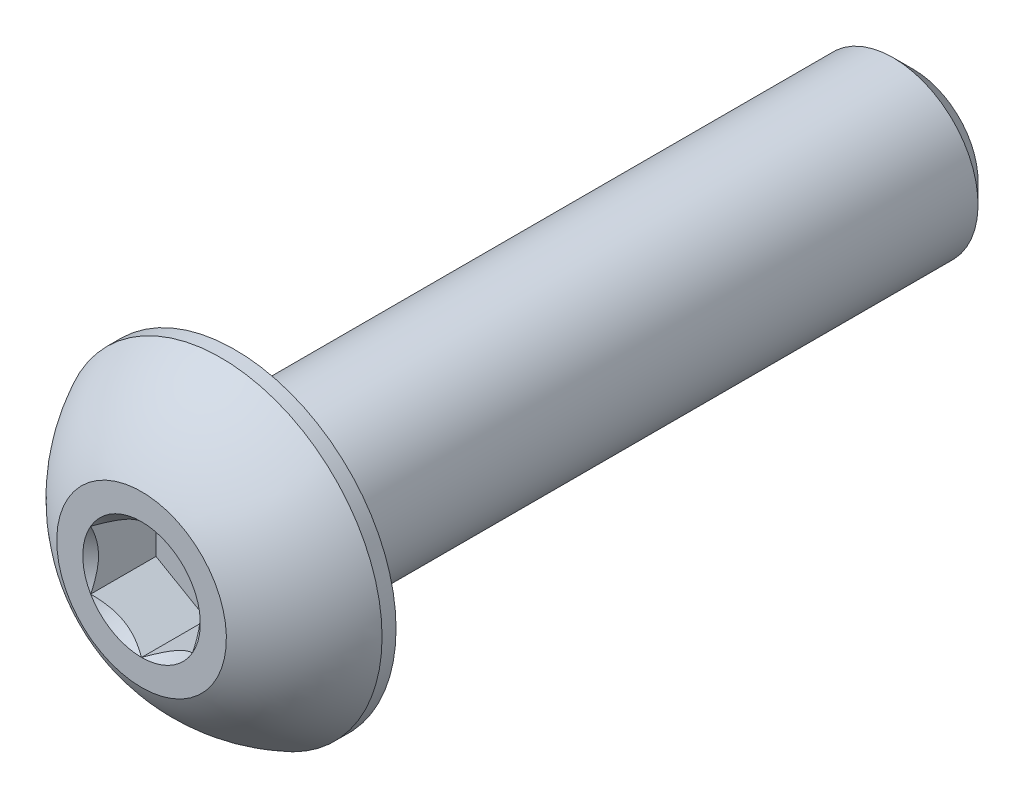
from build123d import *

# Parameters (mm, degrees)
SKETCH1_W          = 20
SKETCH1_H          = 2.5
CHAMFER1_SIZE      = 0.6
CUT_EXTRUDE2_DEPTH = 1.925


with BuildPart() as part:
    # Sketch1 → Revolve1 (revolve)
    with BuildSketch(Plane(origin=(0, 0, 0), x_dir=(0, 0, -1), z_dir=(1, 0, 0))):
        with Locations((12.75, 1.25)):
            Rectangle(SKETCH1_W, SKETCH1_H)
    revolve(axis=Axis((0, 0, -22.75), (0, 0, 1)))

    # Chamfer1
    chamfer1_edges = [part.edges().sort_by_distance(p)[0] for p in [
        (0, -2.5, -22.75),
    ]]
    chamfer(chamfer1_edges, length=CHAMFER1_SIZE)

    # Sketch7 → Revolve2 (revolve)
    with BuildSketch(Plane(origin=(0, 0, 0), x_dir=(0, 0, -1), z_dir=(1, 0, 0))):
        with BuildLine():
            Line((2.3375, 4.75), (2.75, 4.75))
            Line((2.75, 4.75), (2.75, 0))
            Line((2.75, 0), (0, 0))
            Line((0, 0), (0, 2.5))
            ThreePointArc((0, 2.5), (0.991875183, 3.808753282), (2.3375, 4.75))
        make_face()
    revolve(axis=Axis((0, 0, 0), (0, 0, -1)))

    # Sketch5 → Cut-Extrude2 (cut)
    with BuildSketch(Plane.XY):
        Polygon((1.5, -0.866025404), (1.5, 0.866025404), (0, 1.732050808), (-1.5, 0.866025404), (-1.5, -0.866025404), (0, -1.732050808), align=None)
    extrude(amount=-CUT_EXTRUDE2_DEPTH, mode=Mode.SUBTRACT)

    # Cut-Extrude3 cone 1 section (through the dimple's axis) → Cut-Extrude3 (revolve, cut)
    with BuildSketch(Plane(origin=(0, 0, 0), x_dir=(0, -1, 0), z_dir=(1, 0, 0))):
        Polygon((0, 0), (1.732050808, 0), (0, 1.732050808), align=None)
    revolve(axis=Axis((0, 0, 0), (0, 0, -1)), mode=Mode.SUBTRACT)


solid = part.part
